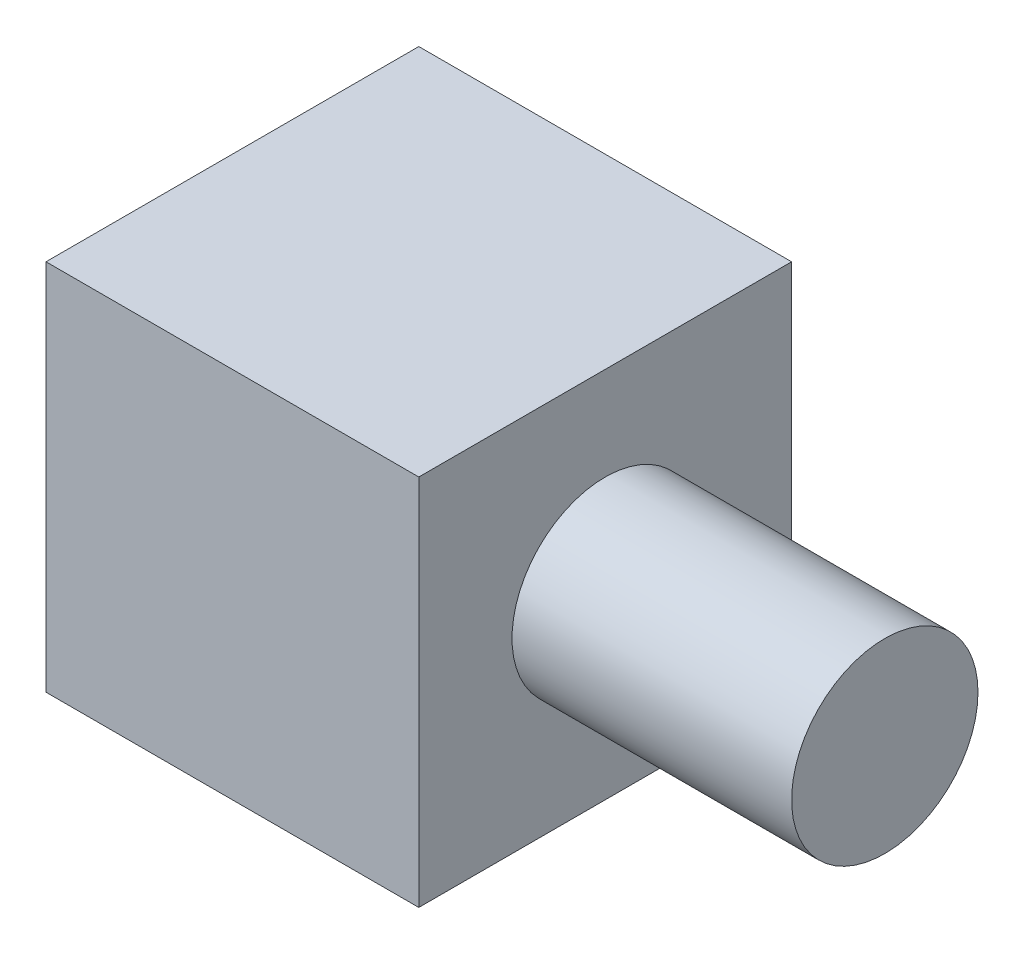
from build123d import *

# Parameters (mm, degrees)
SKETCH_1_W      = 100
SKETCH_1_H      = 100
EXTRUDE_1_DEPTH = 100
SKETCH_2_R      = 25
EXTRUDE_2_DEPTH = 75


with BuildPart() as part:
    # Эскиз1 → Бобышка-Вытянуть1 (new body)
    with BuildSketch(Plane.XY):
        Rectangle(SKETCH_1_W, SKETCH_1_H)
    extrude(amount=EXTRUDE_1_DEPTH)

    # Эскиз2 → Бобышка-Вытянуть2 (add)
    with BuildSketch(Plane(origin=(50, 0, 0), x_dir=(0, 0, -1), z_dir=(1, 0, 0))):
        with Locations((-50, 0)):
            Circle(SKETCH_2_R)
    extrude(amount=EXTRUDE_2_DEPTH)


solid = part.part
